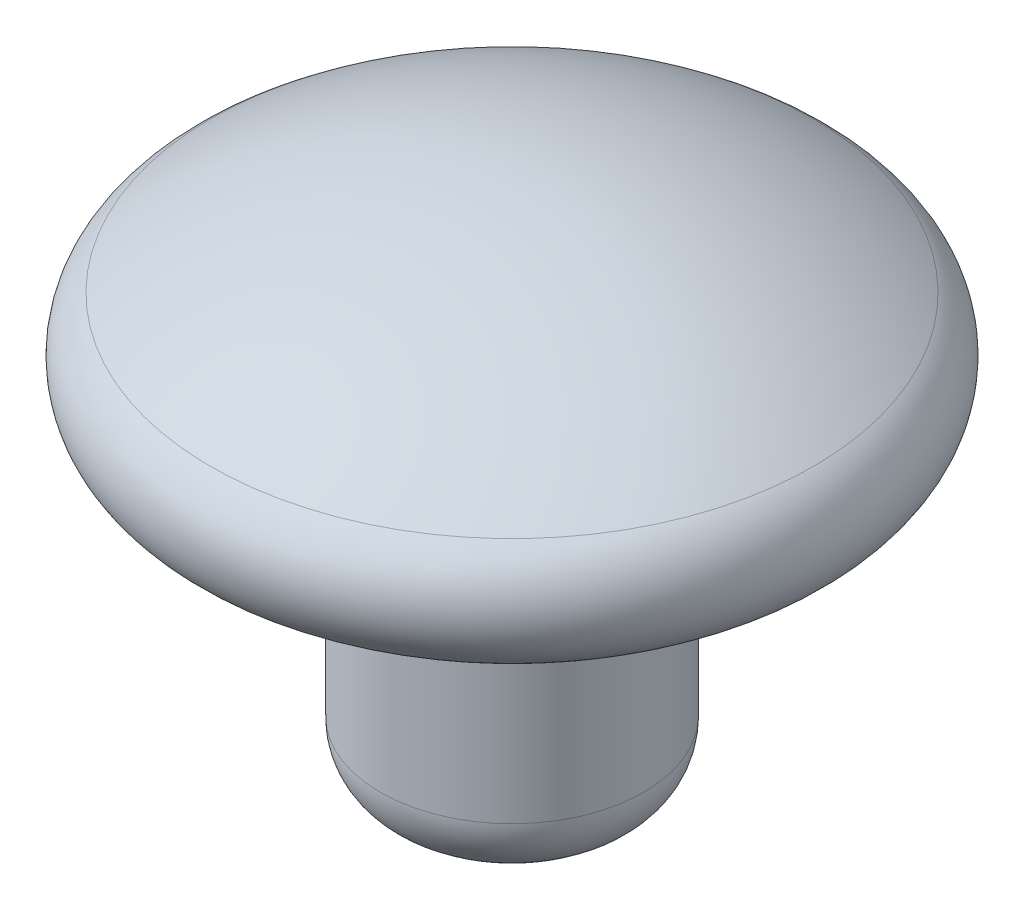
from build123d import *


with BuildPart() as part:
    # Croquis1 → Revolución1 (revolve)
    with BuildSketch(Plane.XY):
        with BuildLine():
            Line((-1, 0), (0, 0))
            Line((0, 0), (0, 8))
            ThreePointArc((0, 8), (-2.395650681, 7.632880047), (-4.571428571, 6.565214453))
            ThreePointArc((-4.571428571, 6.565214453), (-4.97267486, 5.512391122), (-4.139173101, 4.754294578))
            Line((-4.139173101, 4.754294578), (-2.43041345, 4.51414407))
            ThreePointArc((-2.43041345, 4.51414407), (-2.12264521, 4.34703955), (-2, 4.019010036))
            Line((-2, 4.019010036), (-2, 1))
            ThreePointArc((-2, 1), (-1.707106781, 0.292893219), (-1, 0))
        make_face()
    revolve(axis=Axis((0, 0, 0), (0, 1, 0)))


solid = part.part
